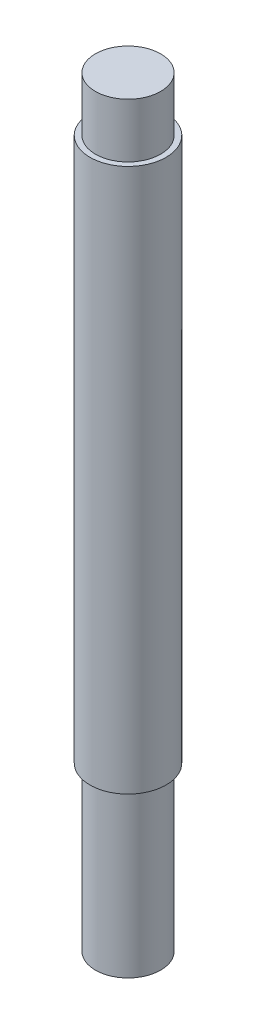
from build123d import *


with BuildPart() as part:
    # Croquis1 → Revolución1 (revolve)
    with BuildSketch(Plane.XY, mode=Mode.PRIVATE) as revoluci_n1_sk:
        Polygon((0, 30), (3, 30), (3, 25), (3.5, 25), (3.5, -25), (3, -25), (3, -40), (0, -40), align=None)
    revolve(revoluci_n1_sk.sketch.rotate(Axis((0, 0, 0), (0, 1, 0)), 90), axis=Axis((0, 0, 0), (0, 1, 0)))


solid = part.part
